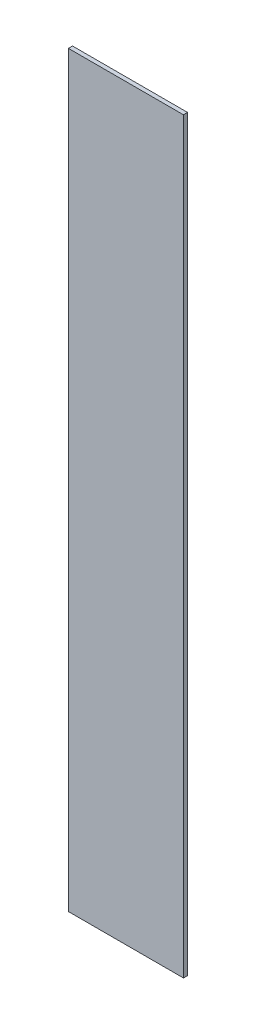
from build123d import *

# Parameters (mm, degrees)
PACK_PANO_KAPAGI_KULP_CUKURU_1_START = 26
SKETCH1_W                            = 28
SKETCH1_H                            = 182
PACK_PANO_KAPAGI_KULP_CUKURU_1_DEPTH = 1


with BuildPart() as part:
    # Sketch1 → PACK_pano_kapagi_kulp_cukuru_1 (new body)
    with BuildSketch(Plane.XY.offset(PACK_PANO_KAPAGI_KULP_CUKURU_1_START)):
        with Locations((637, 210)):
            Rectangle(SKETCH1_W, SKETCH1_H)
    extrude(amount=PACK_PANO_KAPAGI_KULP_CUKURU_1_DEPTH)


solid = part.part
